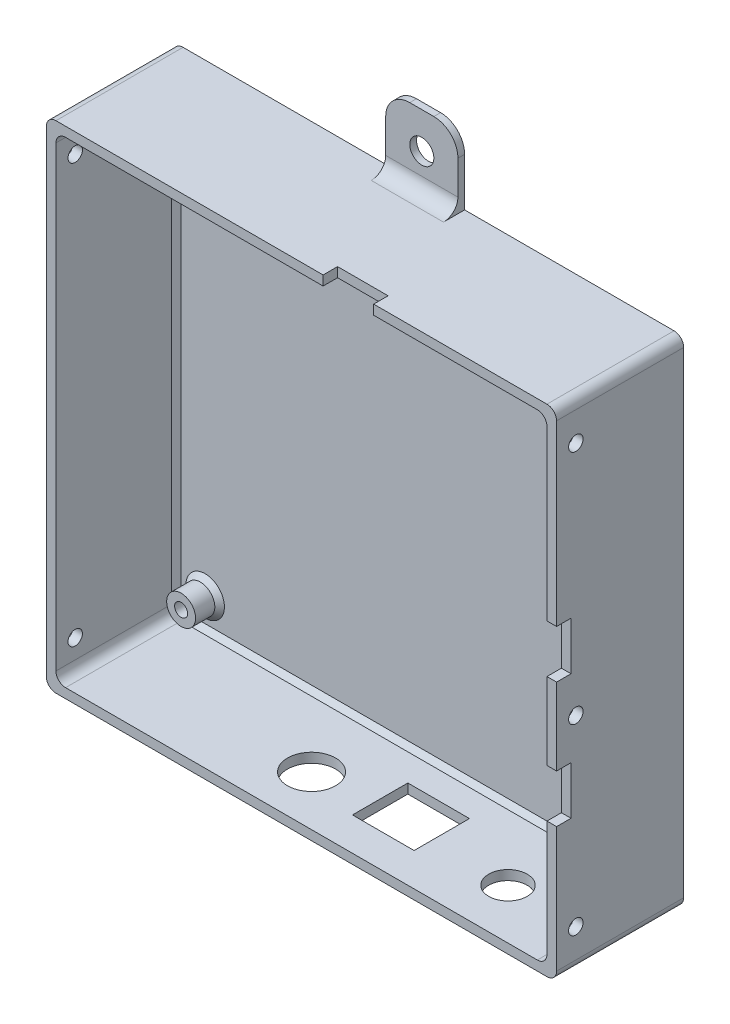
from build123d import *

# Parameters (mm, degrees)
SKETCH_1_W          = 106
SKETCH_1_H          = 103
SKETCH_1_W_2        = 102
SKETCH_1_H_2        = 99
EXTRUDE_1_DEPTH     = 25
SKETCH_2_W          = 106
SKETCH_2_H          = 103
EXTRUDE_2_DEPTH     = 1.4
SKETCH_3_R          = 3
SKETCH_3_R_2        = 1.35
EXTRUDE_3_DEPTH     = 5
SKETCH_4_W          = 12.8
SKETCH_4_H          = 11.5
CUT_EXTRUDE_1_DEPTH = 101
FILLET_1_R          = 2
CHAMFER_1_SIZE      = 1
SKETCH_5_R          = 4
SKETCH_5_R_2        = 5
CUT_EXTRUDE_2_DEPTH = 2
SKETCH_6_W          = 3
SKETCH_6_H          = 10
CUT_EXTRUDE_3_DEPTH = 2
SKETCH_8_R          = 1.5
CUT_EXTRUDE_4_DEPTH = 121.470950855
SKETCH_9_R          = 1.5
CUT_EXTRUDE_5_DEPTH = 2
SKETCH_10_W         = 10.5
SKETCH_10_H         = 3
CUT_EXTRUDE_6_DEPTH = 2
SKETCH_11_R         = 2.5
EXTRUDE_4_DEPTH     = 1.4
FILLET_2_R          = 3


with BuildPart() as part:
    # Эскиз1 → Бобышка-Вытянуть1 (new body)
    with BuildSketch(Plane.XY):
        Rectangle(SKETCH_1_W, SKETCH_1_H)
        Rectangle(SKETCH_1_W_2, SKETCH_1_H_2, mode=Mode.SUBTRACT)
    extrude(amount=EXTRUDE_1_DEPTH)

    # Эскиз2 → Бобышка-Вытянуть2 (add)
    with BuildSketch(Plane(origin=(0, 0, 0), x_dir=(-1, 0, 0), z_dir=(0, 0, -1))):
        Rectangle(SKETCH_2_W, SKETCH_2_H)
    extrude(amount=EXTRUDE_2_DEPTH)

    # Эскиз3 → Бобышка-Вытянуть3 (add)
    # profile 1 of 4: a face of its own
    with BuildSketch(Plane.XY):
        with Locations(Location((-45, 39.5, 0), (0, 0, 180))):
            Circle(SKETCH_3_R)
        with Locations((-45, 39.5)):
            Circle(SKETCH_3_R_2, mode=Mode.SUBTRACT)
    # profile 2 of 4: a face of its own
    with BuildSketch(Plane.XY):
        with Locations(Location((45, 39.5, 0), (0, 0, 180))):
            Circle(SKETCH_3_R)
        with Locations((45, 39.5)):
            Circle(SKETCH_3_R_2, mode=Mode.SUBTRACT)
    # profile 3 of 4: a face of its own
    with BuildSketch(Plane.XY):
        with Locations(Location((-45, -43.5, 0), (0, 0, 180))):
            Circle(SKETCH_3_R)
        with Locations((-45, -43.5)):
            Circle(SKETCH_3_R_2, mode=Mode.SUBTRACT)
    # profile 4 of 4: a face of its own
    with BuildSketch(Plane.XY):
        with Locations(Location((45, -43.5, 0), (0, 0, 180))):
            Circle(SKETCH_3_R)
        with Locations((45, -43.5)):
            Circle(SKETCH_3_R_2, mode=Mode.SUBTRACT)
    extrude(amount=EXTRUDE_3_DEPTH)

    # Эскиз4 → Вырез-Вытянуть1 (cut)
    with BuildSketch(Plane.XZ.offset(51.5)):
        with Locations((10.1, 12.35)):
            Rectangle(SKETCH_4_W, SKETCH_4_H)
    extrude(amount=-CUT_EXTRUDE_1_DEPTH, mode=Mode.SUBTRACT)

    # Скругление1
    fillet_1_edges = [part.edges().sort_by_distance(p)[0] for p in [
        (51, -49.5, 12.5),
        (51, 49.5, 12.5),
        (-51, 49.5, 12.5),
        (-51, -49.5, 12.5),
        (53, -51.5, 11.8),
        (-53, -51.5, 11.8),
        (-53, 51.5, 11.8),
        (53, 51.5, 11.8),
    ]]
    fillet(fillet_1_edges, radius=FILLET_1_R)

    # Фаска1
    chamfer_1_edges = [part.edges().sort_by_distance(p)[0] for p in [
        (-51, 0, 0),
        (0, -49.5, 0),
        (51, 0, 0),
        (0, 49.5, 0),
        (50.414213562, -48.914213562, 0),
        (50.414213562, 48.914213562, 0),
        (-50.414213562, 48.914213562, 0),
        (-50.414213562, -48.914213562, 0),
        (-42, 39.5, 0),
        (48, 39.5, 0),
        (-42, -43.5, 0),
        (48, -43.5, 0),
    ]]
    chamfer(chamfer_1_edges, length=CHAMFER_1_SIZE)

    # Эскиз5 → Вырез-Вытянуть2 (cut)
    with BuildSketch(Plane.XZ.offset(51.5)):
        with Locations(Location((32.5, 14.6, 0), (0, 0, 270))):
            Circle(SKETCH_5_R)
        with Locations(Location((-8.3, 14.6, 0), (0, 0, 270))):
            Circle(SKETCH_5_R_2)
    extrude(amount=-CUT_EXTRUDE_2_DEPTH, mode=Mode.SUBTRACT)

    # Эскиз6 → Вырез-Вытянуть3 (cut)
    with BuildSketch(Plane(origin=(53, 0, 0), x_dir=(0, 0, -1), z_dir=(1, 0, 0))):
        with Locations((-23.5, -18.5)):
            Rectangle(SKETCH_6_W, SKETCH_6_H)
        with Locations((-23.5, 7.5)):
            Rectangle(SKETCH_6_W, SKETCH_6_H)
    extrude(amount=-CUT_EXTRUDE_3_DEPTH, mode=Mode.SUBTRACT)

    # Эскиз8 → Вырез-Вытянуть4 (cut, through all)
    with BuildSketch(Plane(origin=(53, 0, 0), x_dir=(0, 0, -1), z_dir=(1, 0, 0))):
        with Locations((-21, 43.5)):
            Circle(SKETCH_8_R)
        with Locations((-21, -43.5)):
            Circle(SKETCH_8_R)
    extrude(amount=-CUT_EXTRUDE_4_DEPTH, mode=Mode.SUBTRACT)

    # Эскиз9 → Вырез-Вытянуть5 (cut)
    with BuildSketch(Plane(origin=(53, 0, 0), x_dir=(0, 0, -1), z_dir=(1, 0, 0))):
        with Locations((-21, -5.5)):
            Circle(SKETCH_9_R)
    extrude(amount=-CUT_EXTRUDE_5_DEPTH, mode=Mode.SUBTRACT)

    # Эскиз10 → Вырез-Вытянуть6 (cut)
    with BuildSketch(Plane(origin=(0, 51.5, 0), x_dir=(1, 0, 0), z_dir=(0, 1, 0))):
        with Locations((9.75, -23.5)):
            Rectangle(SKETCH_10_W, SKETCH_10_H)
    extrude(amount=-CUT_EXTRUDE_6_DEPTH, mode=Mode.SUBTRACT)

    # Эскиз11 → Бобышка-Вытянуть4 (add)
    with BuildSketch(Plane(origin=(0, 0, -1.4), x_dir=(-1, 0, 0), z_dir=(0, 0, -1))):
        with BuildLine():
            Line((-7.5, 51.5), (7.5, 51.5))
            Line((7.5, 51.5), (7.5, 61.5))
            ThreePointArc((7.5, 61.5), (6.035533906, 65.035533906), (2.5, 66.5))
            Line((2.5, 66.5), (-2.5, 66.5))
            ThreePointArc((-2.5, 66.5), (-6.035533906, 65.035533906), (-7.5, 61.5))
            Line((-7.5, 61.5), (-7.5, 51.5))
        make_face()
        with Locations((0, 59)):
            Circle(SKETCH_11_R, mode=Mode.SUBTRACT)
    extrude(amount=-EXTRUDE_4_DEPTH)

    # Скругление2
    fillet_2_edges = [part.edges().sort_by_distance(p)[0] for p in [
        (0, 51.5, 0),
    ]]
    fillet(fillet_2_edges, radius=FILLET_2_R)


solid = part.part
